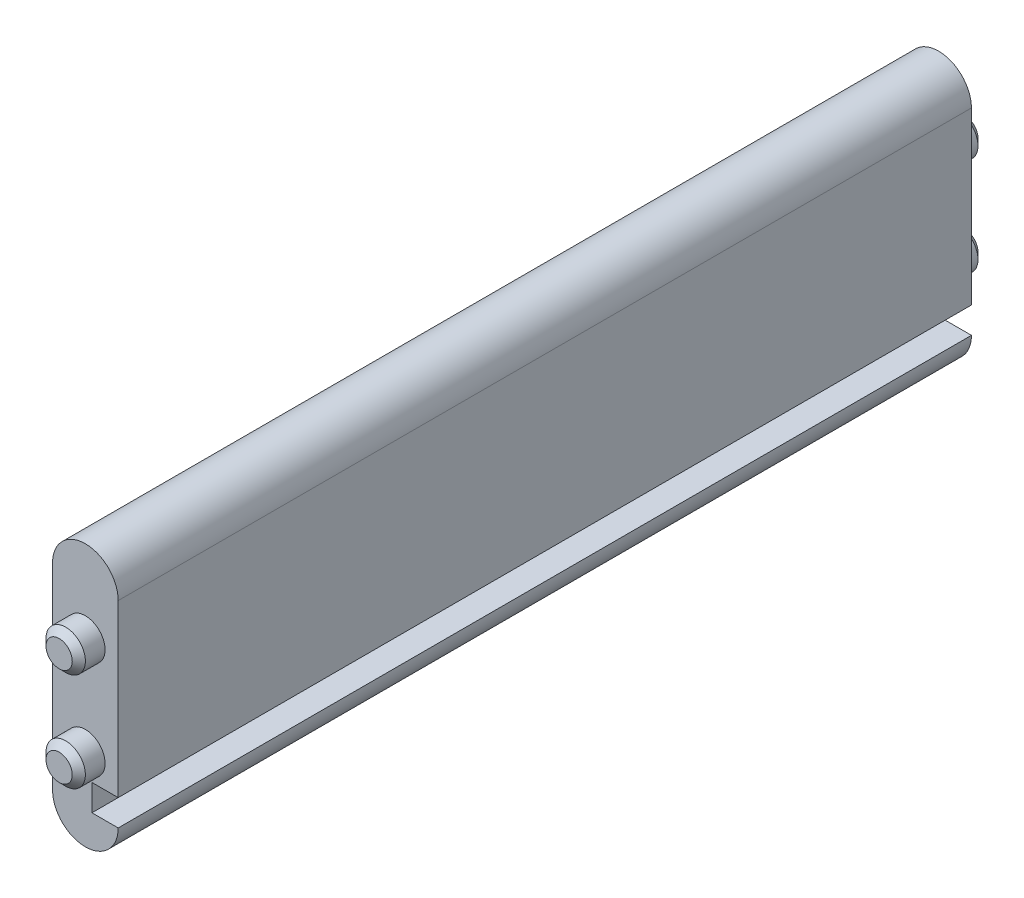
from build123d import *

# Parameters (mm, degrees)
EXTRUDE_1_DEPTH            = 65
SKETCH_2_R                 = 3
EXTRUDE_2_DEPTH            = 4
CHAMFER_1_SIZE             = 1
CHAMFER_1_OF_MIRROR_1_SIZE = 1


with BuildPart() as part:
    # 草圖1 → 伸長1 (new, symmetric)
    with BuildSketch(Plane.XY):
        with BuildLine():
            Line((-5, 15), (-5, -15))
            ThreePointArc((-5, -15), (0, -20), (5, -15))
            Line((5, -15), (1, -15))
            Line((1, -15), (1, -11))
            Line((1, -11), (5, -11))
            Line((5, -11), (5, 15))
            ThreePointArc((5, 15), (0, 20), (-5, 15))
        make_face()
    extrude(amount=EXTRUDE_1_DEPTH, both=True)

    # 草圖2 → 伸長2 (add)
    with BuildSketch(Plane.XY.offset(65)):
        with Locations(Location((0, 7.5, 0), (0, 0, 180))):
            Circle(SKETCH_2_R)
        with Locations(Location((0, -7.5, 0), (0, 0, 180))):
            Circle(SKETCH_2_R)
    extrude_2 = extrude(amount=EXTRUDE_2_DEPTH)

    # 導角1
    chamfer_1_edges = [part.edges().sort_by_distance(p)[0] for p in [
        (3, 7.5, 69),
        (3, -7.5, 69),
    ]]
    chamfer(chamfer_1_edges, length=CHAMFER_1_SIZE)

    # 鏡射1: 伸長2 across plane
    add(extrude_2.mirror(Plane.XY))

    # 導角1 of 鏡射1
    chamfer_1_of_mirror_1_edges = [part.edges().sort_by_distance(p)[0] for p in [
        (3, 7.5, -69),
        (3, -7.5, -69),
    ]]
    chamfer(chamfer_1_of_mirror_1_edges, length=CHAMFER_1_OF_MIRROR_1_SIZE)


solid = part.part
